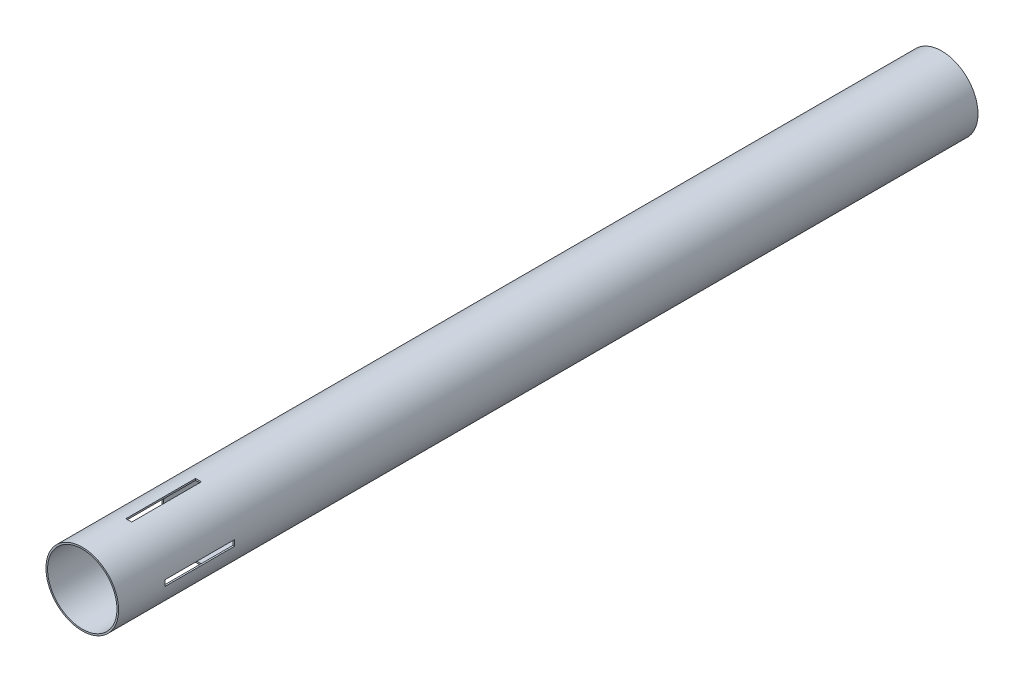
from build123d import *

# Parameters (mm, degrees)
SKETCH1_R               = 39.7129
SKETCH1_R_2             = 37.9603
BOSS_EXTRUDE1_DEPTH     = 939.8
CUT_EXTRUDE1_DEPTH      = 942.476642755
CUT_EXTRUDE1_DEPTH_BACK = 942.476642755
SKETCH3_W               = 6.35
SKETCH3_H               = 76.2
CUT_EXTRUDE2_DEPTH      = 942.476642755
CUT_EXTRUDE2_DEPTH_BACK = 942.476642755
SKETCH4_W               = 76.2
SKETCH4_H               = 6.35


with BuildPart() as part:
    # Sketch1 → Boss-Extrude1 (new body)
    with BuildSketch(Plane.XY):
        Circle(SKETCH1_R)
        Circle(SKETCH1_R_2, mode=Mode.SUBTRACT)
    extrude(amount=BOSS_EXTRUDE1_DEPTH)

    # Sketch3 → Cut-Extrude1 (cut, two sides: drawn at the far end of the back side and taken through both)
    with BuildSketch(Plane(origin=(0, 0, 0), x_dir=(1, 0, 0), z_dir=(0, 1, 0)).offset(-CUT_EXTRUDE1_DEPTH_BACK)):
        with Locations((0, -850.9)):
            Rectangle(SKETCH3_W, SKETCH3_H)
    extrude(amount=CUT_EXTRUDE1_DEPTH + CUT_EXTRUDE1_DEPTH_BACK, mode=Mode.SUBTRACT)

    # Sketch4 → Cut-Extrude2 (cut, two sides: drawn at the far end of the back side and taken through both)
    with BuildSketch(Plane(origin=(0, 0, 0), x_dir=(0, 0, -1), z_dir=(1, 0, 0)).offset(-CUT_EXTRUDE2_DEPTH_BACK)):
        with Locations((-850.9, 0)):
            Rectangle(SKETCH4_W, SKETCH4_H)
    extrude(amount=CUT_EXTRUDE2_DEPTH + CUT_EXTRUDE2_DEPTH_BACK, mode=Mode.SUBTRACT)


solid = part.part
